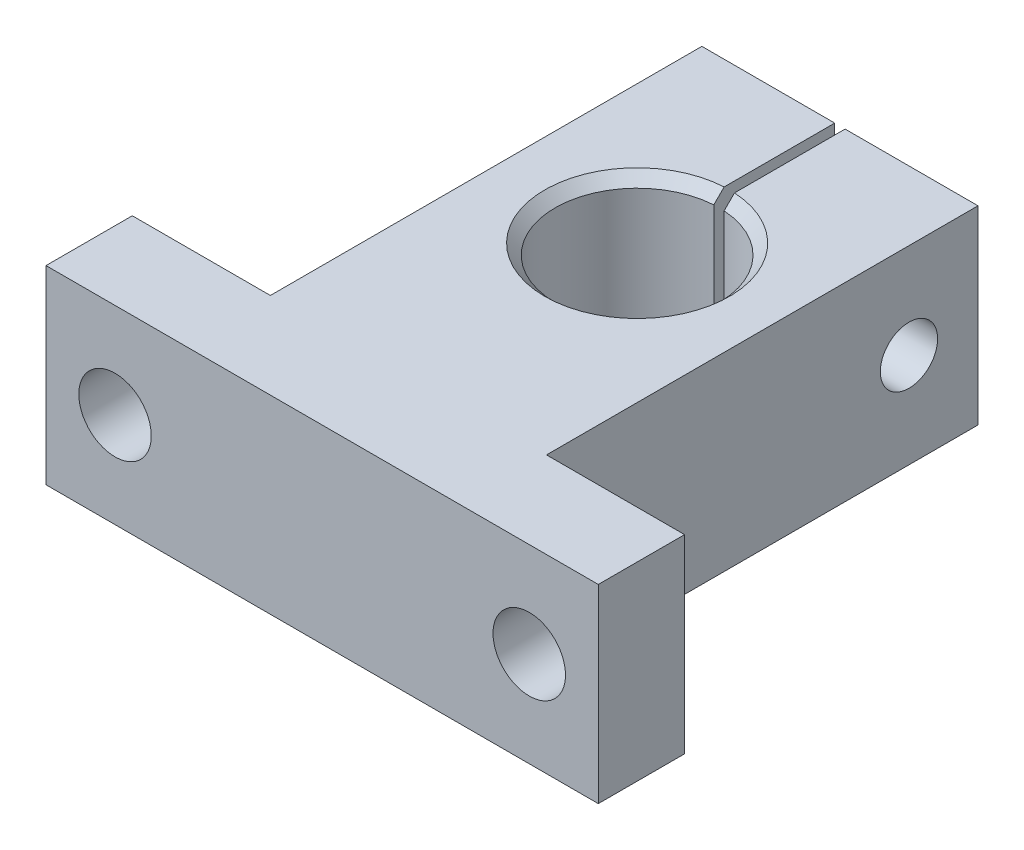
from build123d import *

# Parameters (mm, degrees)
BOSS_EXTRUDE1_DEPTH = 13.97
SKETCH2_R           = 2.667
CUT_EXTRUDE1_DEPTH  = 13.97
SKETCH3_R           = 3.81
CUT_EXTRUDE2_DEPTH  = 4.826
SKETCH4_R           = 2.1082
CUT_EXTRUDE3_DEPTH  = 17.272
CHAMFER1_SIZE       = 0.762


with BuildPart() as part:
    # Sketch1 → Boss-Extrude1 (new body)
    with BuildSketch(Plane(origin=(0, 0, 0), x_dir=(1, 0, 0), z_dir=(0, 1, 0))):
        with BuildLine():
            Line((10.16, 14.9225), (0.381, 14.9225))
            Line((0.381, 14.9225), (0.381, 6.020456399))
            ThreePointArc((0.381, 6.020456399), (0, -6.0325), (-0.381, 6.020456399))
            Line((-0.381, 6.020456399), (-0.381, 14.9225))
            Line((-0.381, 14.9225), (-10.16, 14.9225))
            Line((-10.16, 14.9225), (-10.16, -16.8275))
            Line((-10.16, -16.8275), (-20.32, -16.8275))
            Line((-20.32, -16.8275), (-20.32, -23.1775))
            Line((-20.32, -23.1775), (20.32, -23.1775))
            Line((20.32, -23.1775), (20.32, -16.8275))
            Line((20.32, -16.8275), (10.16, -16.8275))
            Line((10.16, -16.8275), (10.16, 14.9225))
        make_face()
    extrude(amount=BOSS_EXTRUDE1_DEPTH)

    # Sketch2 → Cut-Extrude1 (cut)
    with BuildSketch(Plane(origin=(0, 0, 16.8275), x_dir=(-1, 0, 0), z_dir=(0, 0, -1))):
        with Locations((-15.24, 6.985)):
            Circle(SKETCH2_R)
        with Locations((15.24, 6.985)):
            Circle(SKETCH2_R)
    extrude(amount=-CUT_EXTRUDE1_DEPTH, mode=Mode.SUBTRACT)

    # Sketch3 → Cut-Extrude2 (cut)
    with BuildSketch(Plane.ZY.offset(10.16)):
        with Locations((-9.8425, 6.985)):
            Circle(SKETCH3_R)
    extrude(amount=-CUT_EXTRUDE2_DEPTH, mode=Mode.SUBTRACT)

    # Sketch4 → Cut-Extrude3 (cut)
    with BuildSketch(Plane.ZY.offset(5.334)):
        with Locations((-9.8425, 6.985)):
            Circle(SKETCH4_R)
    extrude(amount=-CUT_EXTRUDE3_DEPTH, mode=Mode.SUBTRACT)

    # Chamfer1
    chamfer1_edges = [part.edges().sort_by_distance(p)[0] for p in [
        (0, 0, 6.0325),
        (0, 13.97, 6.0325),
        (17.907, 6.985, 16.8275),
        (-12.573, 6.985, 16.8275),
        (-10.16, 6.985, -13.6525),
    ]]
    chamfer(chamfer1_edges, length=CHAMFER1_SIZE)


solid = part.part
